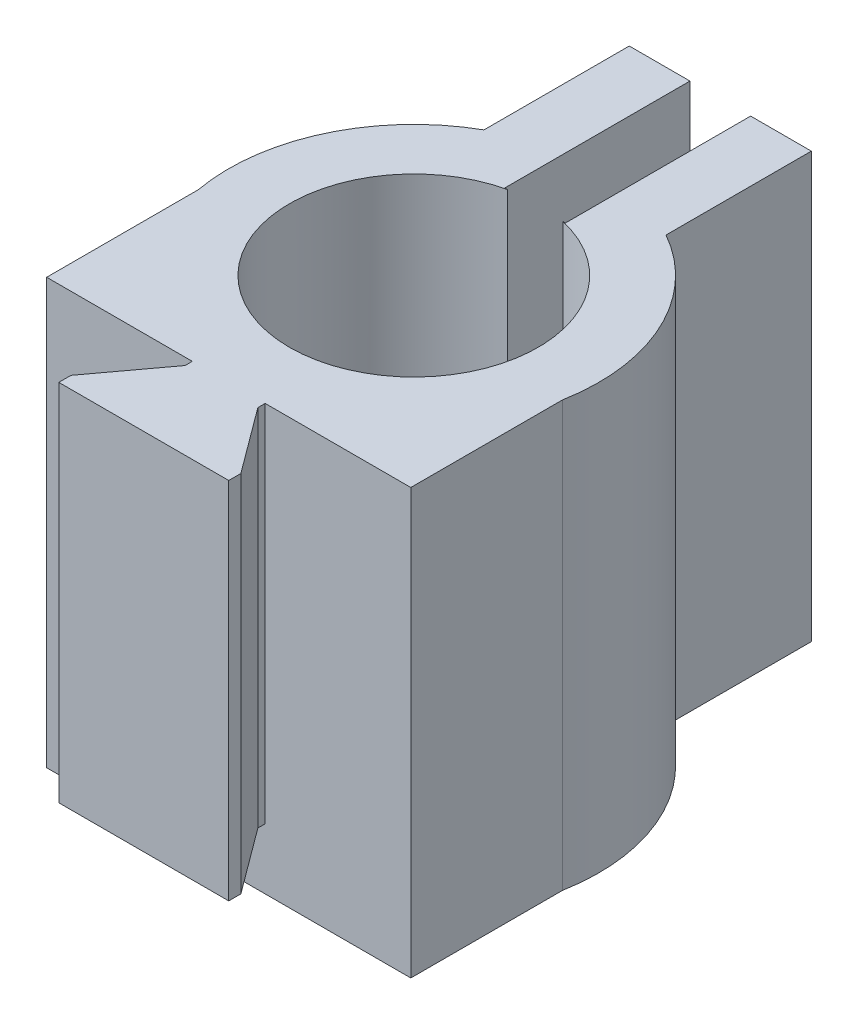
from build123d import *

# Parameters (mm, degrees)
SCHIZZO1_R                   = 15.25
SCHIZZO1_R_2                 = 10.25
ESTRUSIONE_ESTRUSIONE1_DEPTH = 30
SCHIZZO4_W                   = 15
SCHIZZO4_H                   = 15
ESTRUSIONE_ESTRUSIONE2_DEPTH = 30
SCHIZZO5_W                   = 5
SCHIZZO5_H                   = 15.257950375
TAGLIO_ESTRUSIONE1_DEPTH     = 30
ESTRUSIONE_ESTRUSIONE3_DEPTH = 30
ESTRUSIONE_ESTRUSIONE4_START = 5
ESTRUSIONE_ESTRUSIONE4_DEPTH = 5


with BuildPart() as part:
    # Schizzo1 → Estrusione-Estrusione1 (new body)
    with BuildSketch(Plane(origin=(0, 0, 0), x_dir=(1, 0, 0), z_dir=(0, 1, 0))):
        with Locations(Location((0, 0, 0), (0, 0, 270))):
            Circle(SCHIZZO1_R)
        with Locations(Location((0, 0, 0), (0, 0, 270))):
            Circle(SCHIZZO1_R_2, mode=Mode.SUBTRACT)
    extrude(amount=ESTRUSIONE_ESTRUSIONE1_DEPTH)

    # Schizzo4 → Estrusione-Estrusione2 (add)
    with BuildSketch(Plane.XZ):
        with Locations((0, -17.75)):
            Rectangle(SCHIZZO4_W, SCHIZZO4_H)
    extrude(amount=-ESTRUSIONE_ESTRUSIONE2_DEPTH)

    # Schizzo5 → Taglio-Estrusione1 (cut)
    with BuildSketch(Plane.XZ):
        with Locations((0, -17.621024812)):
            Rectangle(SCHIZZO5_W, SCHIZZO5_H)
    extrude(amount=-TAGLIO_ESTRUSIONE1_DEPTH, mode=Mode.SUBTRACT)

    # Schizzo6 → Estrusione-Estrusione3 (add, through all)
    with BuildSketch(Plane(origin=(0, 30, 0), x_dir=(1, 0, 0), z_dir=(0, 1, 0))):
        with BuildLine():
            Line((3, -15.25), (15, -15.25))
            Line((15, -15.25), (15, -2.75))
            ThreePointArc((15, -2.75), (0, -15.25), (-15, -2.75))
            Line((-15, -2.75), (-15, -15.25))
            Line((-15, -15.25), (-3, -15.25))
            Line((-3, -15.25), (-3, -15.85))
            Line((-3, -15.85), (-7, -21.25))
            Line((-7, -21.25), (-7, -22.25))
            Line((-7, -22.25), (7, -22.25))
            Line((7, -22.25), (7, -21.25))
            Line((7, -21.25), (3, -15.85))
            Line((3, -15.85), (3, -15.25))
        make_face()
    extrude(amount=-ESTRUSIONE_ESTRUSIONE3_DEPTH)

    # Schizzo7 → Estrusione-Estrusione4 (add)
    with BuildSketch(Plane.XZ.offset(ESTRUSIONE_ESTRUSIONE4_START)):
        with BuildLine():
            Line((-15, 15.25), (15, 15.25))
            Line((15, 15.25), (15, 2.75))
            ThreePointArc((15, 2.75), (13.812634565, -6.463251997), (7.5, -13.278271725))
            Line((7.5, -13.278271725), (7.5, -25.25))
            Line((7.5, -25.25), (2.5, -25.25))
            Line((2.5, -25.25), (2.5, -9.992049625))
            ThreePointArc((2.5, -9.992049625), (0, 10.25), (-2.5, -9.992049625))
            Line((-2.5, -9.992049625), (-2.5, -25.25))
            Line((-2.5, -25.25), (-7.5, -25.25))
            Line((-7.5, -25.25), (-7.5, -13.278271725))
            ThreePointArc((-7.5, -13.278271725), (-13.812634565, -6.463251997), (-15, 2.75))
            Line((-15, 2.75), (-15, 15.25))
        make_face()
    extrude(amount=-ESTRUSIONE_ESTRUSIONE4_DEPTH)


solid = part.part
